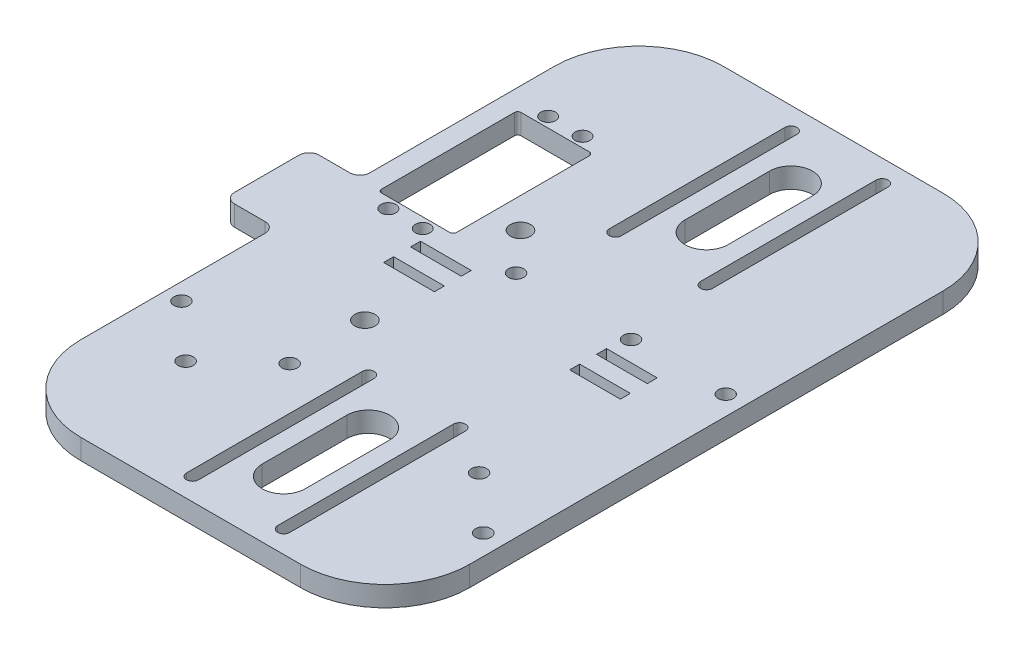
from build123d import *

# Parameters (mm, degrees)
ESQUISSE1_W             = 130
ESQUISSE1_H             = 190
BOSS_EXTRU_1_DEPTH      = 6
ENL_V_MAT_EXTRU_1_DEPTH = 125.342269563
ESQUISSE3_R             = 2.19
ESQUISSE3_W             = 15
ESQUISSE3_H             = 2.95
ENL_V_MAT_EXTRU_2_DEPTH = 125.342269563
ESQUISSE5_R             = 3
ENL_V_MAT_EXTRU_3_DEPTH = 125.342269563
CUT_EXTRUDE1_REACH      = 126.342
SKETCH1_W               = 22.17
SKETCH1_H               = 41.26
FILLET1_R               = 1
M4_CLEARANCE_HOLE1_D    = 4.5
CUT_EXTRUDE2_REACH      = 126.342
SKETCH5_W               = 15
SKETCH5_H               = 82.5
FILLET2_R               = 25
FILLET3_R               = 3
F_8_CLEARANCE_HOLE1_D   = 4.4958


with BuildPart() as part:
    # Esquisse1 → Boss.-Extru.1 (new body)
    with BuildSketch(Plane(origin=(0, 0, 0), x_dir=(1, 0, 0), z_dir=(0, 1, 0))):
        with Locations((-15, 0)):
            Rectangle(ESQUISSE1_W, ESQUISSE1_H)
    extrude(amount=-BOSS_EXTRU_1_DEPTH)

    # Esquisse2 → Enlèv. mat.-Extru.1 (cut, through all)
    with BuildSketch(Plane.XZ.offset(6)):
        with BuildLine():
            Line((-6.35, 75), (-6.35, 50))
            ThreePointArc((-6.35, 50), (0, 43.65), (6.35, 50))
            Line((6.35, 50), (6.35, 75))
            ThreePointArc((6.35, 75), (0, 81.35), (-6.35, 75))
        make_face()
        with BuildLine():
            Line((15.258, 88.470384182), (15.258, 36.529615818))
            ThreePointArc((15.258, 36.529615818), (13.48, 34.751615818), (11.702, 36.529615818))
            Line((11.702, 36.529615818), (11.702, 88.470384182))
            ThreePointArc((11.702, 88.470384182), (13.48, 90.248384182), (15.258, 88.470384182))
        make_face()
        with BuildLine():
            Line((-15.258, 88.470384182), (-15.258, 36.529615818))
            ThreePointArc((-15.258, 36.529615818), (-13.48, 34.751615818), (-11.702, 36.529615818))
            Line((-11.702, 36.529615818), (-11.702, 88.470384182))
            ThreePointArc((-11.702, 88.470384182), (-13.48, 90.248384182), (-15.258, 88.470384182))
        make_face()
        with BuildLine():
            Line((15.258, -88.470384182), (15.258, -36.529615818))
            ThreePointArc((15.258, -36.529615818), (13.48, -34.751615818), (11.702, -36.529615818))
            Line((11.702, -36.529615818), (11.702, -88.470384182))
            ThreePointArc((11.702, -88.470384182), (13.48, -90.248384182), (15.258, -88.470384182))
        make_face()
        with BuildLine():
            Line((-6.35, -75), (-6.35, -50))
            ThreePointArc((-6.35, -50), (0, -43.65), (6.35, -50))
            Line((6.35, -50), (6.35, -75))
            ThreePointArc((6.35, -75), (0, -81.35), (-6.35, -75))
        make_face()
        with BuildLine():
            Line((-15.258, -88.470384182), (-15.258, -36.529615818))
            ThreePointArc((-15.258, -36.529615818), (-13.48, -34.751615818), (-11.702, -36.529615818))
            Line((-11.702, -36.529615818), (-11.702, -88.470384182))
            ThreePointArc((-11.702, -88.470384182), (-13.48, -90.248384182), (-15.258, -88.470384182))
        make_face()
    extrude(amount=-ENL_V_MAT_EXTRU_1_DEPTH, mode=Mode.SUBTRACT)

    # Esquisse3 → Enlèv. mat.-Extru.2 (cut, through all)
    with BuildSketch(Plane.XZ.offset(6)):
        with Locations(Location((-53.085, -9.02, 0), (0, 0, 270))):
            Circle(ESQUISSE3_R)
        with Locations(Location((-42.915, -56.28, 0), (0, 0, 270))):
            Circle(ESQUISSE3_R)
        with Locations(Location((-53.085, -56.28, 0), (0, 0, 270))):
            Circle(ESQUISSE3_R)
        with Locations(Location((-42.915, -9.02, 0), (0, 0, 270))):
            Circle(ESQUISSE3_R)
        with Locations((-32.5, 3.975)):
            Rectangle(ESQUISSE3_W, ESQUISSE3_H)
        with Locations((22.5, 3.975)):
            Rectangle(ESQUISSE3_W, ESQUISSE3_H)
        with Locations((22.5, -3.975)):
            Rectangle(ESQUISSE3_W, ESQUISSE3_H)
        with Locations((-32.5, -3.975)):
            Rectangle(ESQUISSE3_W, ESQUISSE3_H)
    extrude(amount=-ENL_V_MAT_EXTRU_2_DEPTH, mode=Mode.SUBTRACT)

    # Esquisse5 → Enlèv. mat.-Extru.3 (cut, through all)
    with BuildSketch(Plane.XZ.offset(6)):
        with Locations(Location((-28, 23, 0), (0, 0, 270))):
            Circle(ESQUISSE5_R)
        with Locations(Location((-28, -23, 0), (0, 0, 270))):
            Circle(ESQUISSE5_R)
    extrude(amount=-ENL_V_MAT_EXTRU_3_DEPTH, mode=Mode.SUBTRACT)

    # Sketch1 → Cut-Extrude1 (cut, up to next)
    with BuildSketch(Plane.XZ.offset(6), mode=Mode.PRIVATE) as cut_extrude1_sk1:
        with Locations((-48, -32.65)):
            Rectangle(SKETCH1_W, SKETCH1_H)
    cut_extrude1_tool1 = extrude(cut_extrude1_sk1.sketch, amount=-CUT_EXTRUDE1_REACH, mode=Mode.PRIVATE) & part.part
    add(cut_extrude1_tool1.solids().sort_by_distance((-48, -6, -32.65))[0], mode=Mode.SUBTRACT)

    # Fillet1
    fillet1_edges = [part.edges().sort_by_distance(p)[0] for p in [
        (-59.085, -3, -53.28),
        (-59.085, -3, -12.02),
        (-36.915, -3, -12.02),
        (-36.915, -3, -53.28),
    ]]
    fillet(fillet1_edges, radius=FILLET1_R)

    # M4 Clearance Hole1 (through all)
    with Locations(Plane(origin=(0, -6, 0), x_dir=(-1, 0, 0), z_dir=(0, -1, 0))):
        with Locations((-28, -45.2375), (-44, -60), (28, -45.2375), (44, -60), (60, -45.2375)):
            Hole(M4_CLEARANCE_HOLE1_D / 2)

    # Sketch5 → Cut-Extrude2 (cut, up to next)
    with BuildSketch(Plane.XZ.offset(6), mode=Mode.PRIVATE) as cut_extrude2_sk1:
        with Locations((-72.5, 53.75)):
            Rectangle(SKETCH5_W, SKETCH5_H)
    cut_extrude2_tool1 = extrude(cut_extrude2_sk1.sketch, amount=-CUT_EXTRUDE2_REACH, mode=Mode.PRIVATE) & part.part
    # Sketch5 → Cut-Extrude2 (cut, up to next)
    with BuildSketch(Plane.XZ.offset(6), mode=Mode.PRIVATE) as cut_extrude2_sk2:
        with Locations((-72.5, -53.75)):
            Rectangle(SKETCH5_W, SKETCH5_H)
    cut_extrude2_tool2 = extrude(cut_extrude2_sk2.sketch, amount=-CUT_EXTRUDE2_REACH, mode=Mode.PRIVATE) & part.part
    add(cut_extrude2_tool1.solids().sort_by_distance((-72.5, -6, 53.75))[0], mode=Mode.SUBTRACT)
    add(cut_extrude2_tool2.solids().sort_by_distance((-72.5, -6, -53.75))[0], mode=Mode.SUBTRACT)

    # Fillet2
    fillet2_edges = [part.edges().sort_by_distance(p)[0] for p in [
        (-65, -3, 95),
        (-65, -3, -95),
        (50, -3, -95),
        (50, -3, 95),
    ]]
    fillet(fillet2_edges, radius=FILLET2_R)

    # Fillet3
    fillet3_edges = [part.edges().sort_by_distance(p)[0] for p in [
        (-65, -3, 12.5),
        (-80, -3, 12.5),
        (-80, -3, -12.5),
        (-65, -3, -12.5),
    ]]
    fillet(fillet3_edges, radius=FILLET3_R)

    # #8 Clearance Hole1 (through all)
    with Locations(Plane(origin=(0, 0, 0), x_dir=(1, 0, 0), z_dir=(0, 1, 0))):
        with Locations((16.3, 11.394380081), (-17.7, 11.394380081), (44.3, 11.394380081)):
            Hole(F_8_CLEARANCE_HOLE1_D / 2)


solid = part.part
